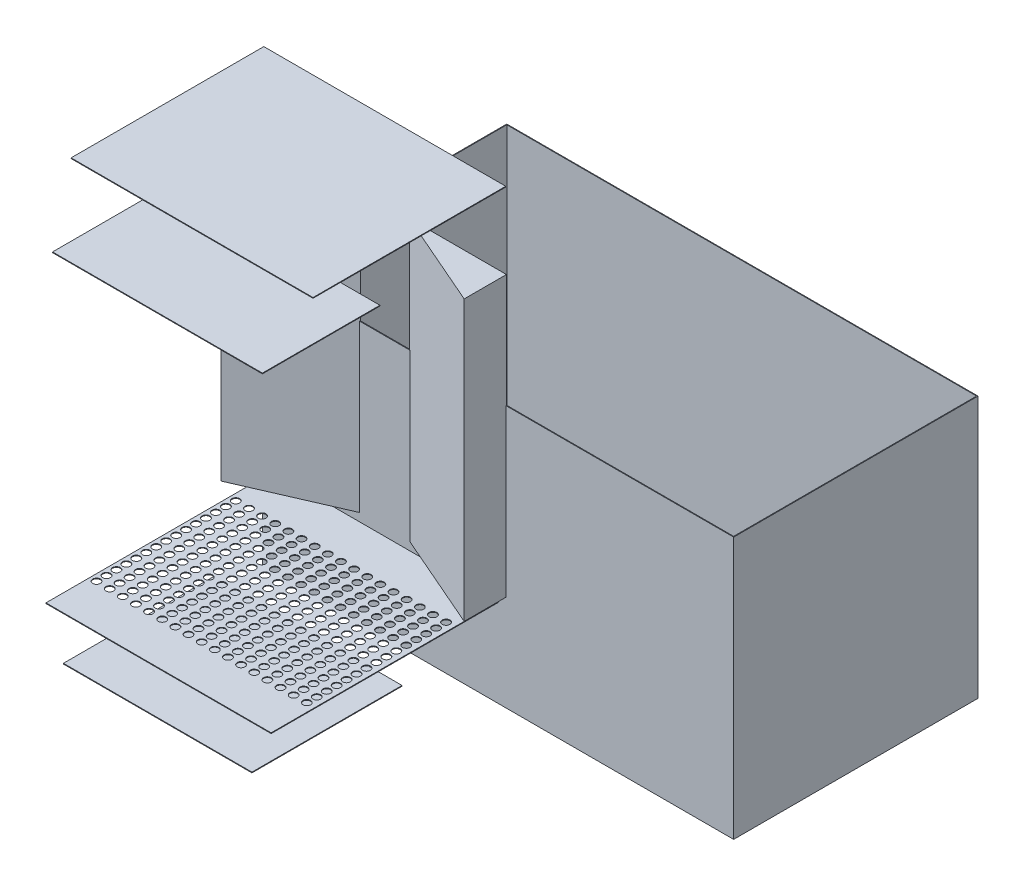
from build123d import *

# Parameters (mm, degrees)
MASTER_FOOTPRINT_W            = 1350
MASTER_FOOTPRINT_H            = 700
BATH_BASE_PLATE_DEPTH         = 750
BATH_SHELL_2MM_T              = -2
INLET_IMPACT_BAFFLE_START     = 125
SKETCH_1_W                    = 540
SKETCH_1_H                    = 430
INLET_IMPACT_BAFFLE_DEPTH     = 2
DISTRIBUTOR_D22_START         = 250
SKETCH_2_W                    = 645
SKETCH_2_H                    = 652
SKETCH_2_R                    = 11
DISTRIBUTOR_D22_DEPTH         = 2
OUTLET_SUBMERGED_BAFFLE_START = 1130
SKETCH_3_W                    = 601.176470588
SKETCH_3_H                    = 336.5
OUTLET_SUBMERGED_BAFFLE_DEPTH = 2
OVERFLOW_WEIR_Z550_START      = 1290
SKETCH_4_W                    = 693
SKETCH_4_H                    = 552
OVERFLOW_WEIR_Z550_DEPTH      = 2
SLOPED_SEDIMENT_FLOOR_START   = 275
SLOPED_SEDIMENT_FLOOR_DEPTH   = 800


with BuildPart() as part:
    # MASTER_FOOTPRINT → BATH_BASE_PLATE (new body)
    with BuildSketch(Plane(origin=(0, 0, 0), x_dir=(1, 0, 0), z_dir=(0, 1, 0))):
        with Locations((675, 350)):
            Rectangle(MASTER_FOOTPRINT_W, MASTER_FOOTPRINT_H)
    extrude(amount=BATH_BASE_PLATE_DEPTH)

    # BATH_SHELL_2MM
    bath_shell_2mm_openings = [part.faces().sort_by_distance(p)[0] for p in [
        (675, 750, -350),
    ]]
    offset(amount=BATH_SHELL_2MM_T, openings=bath_shell_2mm_openings, kind=Kind.INTERSECTION)

    # Эскиз5 → SLOPED_SEDIMENT_FLOOR (add)
    with BuildSketch(Plane(origin=(0, 0, 0), x_dir=(1, 0, 0), z_dir=(0, 1, 0)).offset(SLOPED_SEDIMENT_FLOOR_START)):
        Polygon((2, 1), (2, -120), (280, 1), align=None)
        Polygon((698, 1), (698, -120), (420, 1), align=None)
    extrude(amount=SLOPED_SEDIMENT_FLOOR_DEPTH)


with BuildPart() as body_2:
    # Эскиз1 → INLET_IMPACT_BAFFLE (new body)
    with BuildSketch(Plane(origin=(0, 0, 0), x_dir=(1, 0, 0), z_dir=(0, 1, 0)).offset(INLET_IMPACT_BAFFLE_START)):
        with Locations((350, -435)):
            Rectangle(SKETCH_1_W, SKETCH_1_H)
    extrude(amount=INLET_IMPACT_BAFFLE_DEPTH)


with BuildPart() as body_3:
    # Эскиз2 → DISTRIBUTOR_D22 (new body)
    with BuildSketch(Plane(origin=(0, 0, 0), x_dir=(1, 0, 0), z_dir=(0, 1, 0)).offset(DISTRIBUTOR_D22_START)):
        with Locations((352.5, -324)):
            Rectangle(SKETCH_2_W, SKETCH_2_H)
        with Locations(Location((48.823529412, -125, 0), (0, 0, 270))):
            Circle(SKETCH_2_R, mode=Mode.SUBTRACT)
        with Locations(Location((48.823529412, -153.5, 0), (0, 0, 270))):
            Circle(SKETCH_2_R, mode=Mode.SUBTRACT)
        with Locations(Location((48.823529412, -182, 0), (0, 0, 270))):
            Circle(SKETCH_2_R, mode=Mode.SUBTRACT)
        with Locations(Location((48.823529412, -210.5, 0), (0, 0, 270))):
            Circle(SKETCH_2_R, mode=Mode.SUBTRACT)
        with Locations(Location((48.823529412, -239, 0), (0, 0, 270))):
            Circle(SKETCH_2_R, mode=Mode.SUBTRACT)
        with Locations(Location((48.823529412, -267.5, 0), (0, 0, 270))):
            Circle(SKETCH_2_R, mode=Mode.SUBTRACT)
        with Locations(Location((48.823529412, -296, 0), (0, 0, 270))):
            Circle(SKETCH_2_R, mode=Mode.SUBTRACT)
        with Locations(Location((48.823529412, -324.5, 0), (0, 0, 270))):
            Circle(SKETCH_2_R, mode=Mode.SUBTRACT)
        with Locations(Location((48.823529412, -353, 0), (0, 0, 270))):
            Circle(SKETCH_2_R, mode=Mode.SUBTRACT)
        with Locations(Location((48.823529412, -381.5, 0), (0, 0, 270))):
            Circle(SKETCH_2_R, mode=Mode.SUBTRACT)
        with Locations(Location((48.823529412, -410, 0), (0, 0, 270))):
            Circle(SKETCH_2_R, mode=Mode.SUBTRACT)
        with Locations(Location((48.823529412, -438.5, 0), (0, 0, 270))):
            Circle(SKETCH_2_R, mode=Mode.SUBTRACT)
        with Locations(Location((48.823529412, -467, 0), (0, 0, 270))):
            Circle(SKETCH_2_R, mode=Mode.SUBTRACT)
        with Locations(Location((48.823529412, -495.5, 0), (0, 0, 270))):
            Circle(SKETCH_2_R, mode=Mode.SUBTRACT)
        with Locations(Location((48.823529412, -524, 0), (0, 0, 270))):
            Circle(SKETCH_2_R, mode=Mode.SUBTRACT)
        with Locations(Location((86.470588235, -125, 0), (0, 0, 270))):
            Circle(SKETCH_2_R, mode=Mode.SUBTRACT)
        with Locations(Location((86.470588235, -153.5, 0), (0, 0, 270))):
            Circle(SKETCH_2_R, mode=Mode.SUBTRACT)
        with Locations(Location((86.470588235, -182, 0), (0, 0, 270))):
            Circle(SKETCH_2_R, mode=Mode.SUBTRACT)
        with Locations(Location((86.470588235, -210.5, 0), (0, 0, 270))):
            Circle(SKETCH_2_R, mode=Mode.SUBTRACT)
        with Locations(Location((86.470588235, -239, 0), (0, 0, 270))):
            Circle(SKETCH_2_R, mode=Mode.SUBTRACT)
        with Locations(Location((86.470588235, -267.5, 0), (0, 0, 270))):
            Circle(SKETCH_2_R, mode=Mode.SUBTRACT)
        with Locations(Location((86.470588235, -296, 0), (0, 0, 270))):
            Circle(SKETCH_2_R, mode=Mode.SUBTRACT)
        with Locations(Location((86.470588235, -324.5, 0), (0, 0, 270))):
            Circle(SKETCH_2_R, mode=Mode.SUBTRACT)
        with Locations(Location((86.470588235, -353, 0), (0, 0, 270))):
            Circle(SKETCH_2_R, mode=Mode.SUBTRACT)
        with Locations(Location((86.470588235, -381.5, 0), (0, 0, 270))):
            Circle(SKETCH_2_R, mode=Mode.SUBTRACT)
        with Locations(Location((86.470588235, -410, 0), (0, 0, 270))):
            Circle(SKETCH_2_R, mode=Mode.SUBTRACT)
        with Locations(Location((86.470588235, -438.5, 0), (0, 0, 270))):
            Circle(SKETCH_2_R, mode=Mode.SUBTRACT)
        with Locations(Location((86.470588235, -467, 0), (0, 0, 270))):
            Circle(SKETCH_2_R, mode=Mode.SUBTRACT)
        with Locations(Location((86.470588235, -495.5, 0), (0, 0, 270))):
            Circle(SKETCH_2_R, mode=Mode.SUBTRACT)
        with Locations(Location((86.470588235, -524, 0), (0, 0, 270))):
            Circle(SKETCH_2_R, mode=Mode.SUBTRACT)
        with Locations(Location((124.117647059, -125, 0), (0, 0, 270))):
            Circle(SKETCH_2_R, mode=Mode.SUBTRACT)
        with Locations(Location((124.117647059, -153.5, 0), (0, 0, 270))):
            Circle(SKETCH_2_R, mode=Mode.SUBTRACT)
        with Locations(Location((124.117647059, -182, 0), (0, 0, 270))):
            Circle(SKETCH_2_R, mode=Mode.SUBTRACT)
        with Locations(Location((124.117647059, -210.5, 0), (0, 0, 270))):
            Circle(SKETCH_2_R, mode=Mode.SUBTRACT)
        with Locations(Location((124.117647059, -239, 0), (0, 0, 270))):
            Circle(SKETCH_2_R, mode=Mode.SUBTRACT)
        with Locations(Location((124.117647059, -267.5, 0), (0, 0, 270))):
            Circle(SKETCH_2_R, mode=Mode.SUBTRACT)
        with Locations(Location((124.117647059, -296, 0), (0, 0, 270))):
            Circle(SKETCH_2_R, mode=Mode.SUBTRACT)
        with Locations(Location((124.117647059, -324.5, 0), (0, 0, 270))):
            Circle(SKETCH_2_R, mode=Mode.SUBTRACT)
        with Locations(Location((124.117647059, -353, 0), (0, 0, 270))):
            Circle(SKETCH_2_R, mode=Mode.SUBTRACT)
        with Locations(Location((124.117647059, -381.5, 0), (0, 0, 270))):
            Circle(SKETCH_2_R, mode=Mode.SUBTRACT)
        with Locations(Location((124.117647059, -410, 0), (0, 0, 270))):
            Circle(SKETCH_2_R, mode=Mode.SUBTRACT)
        with Locations(Location((124.117647059, -438.5, 0), (0, 0, 270))):
            Circle(SKETCH_2_R, mode=Mode.SUBTRACT)
        with Locations(Location((124.117647059, -467, 0), (0, 0, 270))):
            Circle(SKETCH_2_R, mode=Mode.SUBTRACT)
        with Locations(Location((124.117647059, -495.5, 0), (0, 0, 270))):
            Circle(SKETCH_2_R, mode=Mode.SUBTRACT)
        with Locations(Location((124.117647059, -524, 0), (0, 0, 270))):
            Circle(SKETCH_2_R, mode=Mode.SUBTRACT)
        with Locations(Location((161.764705882, -125, 0), (0, 0, 270))):
            Circle(SKETCH_2_R, mode=Mode.SUBTRACT)
        with Locations(Location((161.764705882, -153.5, 0), (0, 0, 270))):
            Circle(SKETCH_2_R, mode=Mode.SUBTRACT)
        with Locations(Location((161.764705882, -182, 0), (0, 0, 270))):
            Circle(SKETCH_2_R, mode=Mode.SUBTRACT)
        with Locations(Location((161.764705882, -210.5, 0), (0, 0, 270))):
            Circle(SKETCH_2_R, mode=Mode.SUBTRACT)
        with Locations(Location((161.764705882, -239, 0), (0, 0, 270))):
            Circle(SKETCH_2_R, mode=Mode.SUBTRACT)
        with Locations(Location((161.764705882, -267.5, 0), (0, 0, 270))):
            Circle(SKETCH_2_R, mode=Mode.SUBTRACT)
        with Locations(Location((161.764705882, -296, 0), (0, 0, 270))):
            Circle(SKETCH_2_R, mode=Mode.SUBTRACT)
        with Locations(Location((161.764705882, -324.5, 0), (0, 0, 270))):
            Circle(SKETCH_2_R, mode=Mode.SUBTRACT)
        with Locations(Location((161.764705882, -353, 0), (0, 0, 270))):
            Circle(SKETCH_2_R, mode=Mode.SUBTRACT)
        with Locations(Location((161.764705882, -381.5, 0), (0, 0, 270))):
            Circle(SKETCH_2_R, mode=Mode.SUBTRACT)
        with Locations(Location((161.764705882, -410, 0), (0, 0, 270))):
            Circle(SKETCH_2_R, mode=Mode.SUBTRACT)
        with Locations(Location((161.764705882, -438.5, 0), (0, 0, 270))):
            Circle(SKETCH_2_R, mode=Mode.SUBTRACT)
        with Locations(Location((161.764705882, -467, 0), (0, 0, 270))):
            Circle(SKETCH_2_R, mode=Mode.SUBTRACT)
        with Locations(Location((161.764705882, -495.5, 0), (0, 0, 270))):
            Circle(SKETCH_2_R, mode=Mode.SUBTRACT)
        with Locations(Location((161.764705882, -524, 0), (0, 0, 270))):
            Circle(SKETCH_2_R, mode=Mode.SUBTRACT)
        with Locations(Location((199.411764706, -125, 0), (0, 0, 270))):
            Circle(SKETCH_2_R, mode=Mode.SUBTRACT)
        with Locations(Location((199.411764706, -153.5, 0), (0, 0, 270))):
            Circle(SKETCH_2_R, mode=Mode.SUBTRACT)
        with Locations(Location((199.411764706, -182, 0), (0, 0, 270))):
            Circle(SKETCH_2_R, mode=Mode.SUBTRACT)
        with Locations(Location((199.411764706, -210.5, 0), (0, 0, 270))):
            Circle(SKETCH_2_R, mode=Mode.SUBTRACT)
        with Locations(Location((199.411764706, -239, 0), (0, 0, 270))):
            Circle(SKETCH_2_R, mode=Mode.SUBTRACT)
        with Locations(Location((199.411764706, -267.5, 0), (0, 0, 270))):
            Circle(SKETCH_2_R, mode=Mode.SUBTRACT)
        with Locations(Location((199.411764706, -296, 0), (0, 0, 270))):
            Circle(SKETCH_2_R, mode=Mode.SUBTRACT)
        with Locations(Location((199.411764706, -324.5, 0), (0, 0, 270))):
            Circle(SKETCH_2_R, mode=Mode.SUBTRACT)
        with Locations(Location((199.411764706, -353, 0), (0, 0, 270))):
            Circle(SKETCH_2_R, mode=Mode.SUBTRACT)
        with Locations(Location((199.411764706, -381.5, 0), (0, 0, 270))):
            Circle(SKETCH_2_R, mode=Mode.SUBTRACT)
        with Locations(Location((199.411764706, -410, 0), (0, 0, 270))):
            Circle(SKETCH_2_R, mode=Mode.SUBTRACT)
        with Locations(Location((199.411764706, -438.5, 0), (0, 0, 270))):
            Circle(SKETCH_2_R, mode=Mode.SUBTRACT)
        with Locations(Location((199.411764706, -467, 0), (0, 0, 270))):
            Circle(SKETCH_2_R, mode=Mode.SUBTRACT)
        with Locations(Location((199.411764706, -495.5, 0), (0, 0, 270))):
            Circle(SKETCH_2_R, mode=Mode.SUBTRACT)
        with Locations(Location((199.411764706, -524, 0), (0, 0, 270))):
            Circle(SKETCH_2_R, mode=Mode.SUBTRACT)
        with Locations(Location((237.058823529, -125, 0), (0, 0, 270))):
            Circle(SKETCH_2_R, mode=Mode.SUBTRACT)
        with Locations(Location((237.058823529, -153.5, 0), (0, 0, 270))):
            Circle(SKETCH_2_R, mode=Mode.SUBTRACT)
        with Locations(Location((237.058823529, -182, 0), (0, 0, 270))):
            Circle(SKETCH_2_R, mode=Mode.SUBTRACT)
        with Locations(Location((237.058823529, -210.5, 0), (0, 0, 270))):
            Circle(SKETCH_2_R, mode=Mode.SUBTRACT)
        with Locations(Location((237.058823529, -239, 0), (0, 0, 270))):
            Circle(SKETCH_2_R, mode=Mode.SUBTRACT)
        with Locations(Location((237.058823529, -267.5, 0), (0, 0, 270))):
            Circle(SKETCH_2_R, mode=Mode.SUBTRACT)
        with Locations(Location((237.058823529, -296, 0), (0, 0, 270))):
            Circle(SKETCH_2_R, mode=Mode.SUBTRACT)
        with Locations(Location((237.058823529, -324.5, 0), (0, 0, 270))):
            Circle(SKETCH_2_R, mode=Mode.SUBTRACT)
        with Locations(Location((237.058823529, -353, 0), (0, 0, 270))):
            Circle(SKETCH_2_R, mode=Mode.SUBTRACT)
        with Locations(Location((237.058823529, -381.5, 0), (0, 0, 270))):
            Circle(SKETCH_2_R, mode=Mode.SUBTRACT)
        with Locations(Location((237.058823529, -410, 0), (0, 0, 270))):
            Circle(SKETCH_2_R, mode=Mode.SUBTRACT)
        with Locations(Location((237.058823529, -438.5, 0), (0, 0, 270))):
            Circle(SKETCH_2_R, mode=Mode.SUBTRACT)
        with Locations(Location((237.058823529, -467, 0), (0, 0, 270))):
            Circle(SKETCH_2_R, mode=Mode.SUBTRACT)
        with Locations(Location((237.058823529, -495.5, 0), (0, 0, 270))):
            Circle(SKETCH_2_R, mode=Mode.SUBTRACT)
        with Locations(Location((237.058823529, -524, 0), (0, 0, 270))):
            Circle(SKETCH_2_R, mode=Mode.SUBTRACT)
        with Locations(Location((274.705882353, -125, 0), (0, 0, 270))):
            Circle(SKETCH_2_R, mode=Mode.SUBTRACT)
        with Locations(Location((274.705882353, -153.5, 0), (0, 0, 270))):
            Circle(SKETCH_2_R, mode=Mode.SUBTRACT)
        with Locations(Location((274.705882353, -182, 0), (0, 0, 270))):
            Circle(SKETCH_2_R, mode=Mode.SUBTRACT)
        with Locations(Location((274.705882353, -210.5, 0), (0, 0, 270))):
            Circle(SKETCH_2_R, mode=Mode.SUBTRACT)
        with Locations(Location((274.705882353, -239, 0), (0, 0, 270))):
            Circle(SKETCH_2_R, mode=Mode.SUBTRACT)
        with Locations(Location((274.705882353, -267.5, 0), (0, 0, 270))):
            Circle(SKETCH_2_R, mode=Mode.SUBTRACT)
        with Locations(Location((274.705882353, -296, 0), (0, 0, 270))):
            Circle(SKETCH_2_R, mode=Mode.SUBTRACT)
        with Locations(Location((274.705882353, -324.5, 0), (0, 0, 270))):
            Circle(SKETCH_2_R, mode=Mode.SUBTRACT)
        with Locations(Location((274.705882353, -353, 0), (0, 0, 270))):
            Circle(SKETCH_2_R, mode=Mode.SUBTRACT)
        with Locations(Location((274.705882353, -381.5, 0), (0, 0, 270))):
            Circle(SKETCH_2_R, mode=Mode.SUBTRACT)
        with Locations(Location((274.705882353, -410, 0), (0, 0, 270))):
            Circle(SKETCH_2_R, mode=Mode.SUBTRACT)
        with Locations(Location((274.705882353, -438.5, 0), (0, 0, 270))):
            Circle(SKETCH_2_R, mode=Mode.SUBTRACT)
        with Locations(Location((274.705882353, -467, 0), (0, 0, 270))):
            Circle(SKETCH_2_R, mode=Mode.SUBTRACT)
        with Locations(Location((274.705882353, -495.5, 0), (0, 0, 270))):
            Circle(SKETCH_2_R, mode=Mode.SUBTRACT)
        with Locations(Location((274.705882353, -524, 0), (0, 0, 270))):
            Circle(SKETCH_2_R, mode=Mode.SUBTRACT)
        with Locations(Location((312.352941176, -125, 0), (0, 0, 270))):
            Circle(SKETCH_2_R, mode=Mode.SUBTRACT)
        with Locations(Location((312.352941176, -153.5, 0), (0, 0, 270))):
            Circle(SKETCH_2_R, mode=Mode.SUBTRACT)
        with Locations(Location((312.352941176, -182, 0), (0, 0, 270))):
            Circle(SKETCH_2_R, mode=Mode.SUBTRACT)
        with Locations(Location((312.352941176, -210.5, 0), (0, 0, 270))):
            Circle(SKETCH_2_R, mode=Mode.SUBTRACT)
        with Locations(Location((312.352941176, -239, 0), (0, 0, 270))):
            Circle(SKETCH_2_R, mode=Mode.SUBTRACT)
        with Locations(Location((312.352941176, -267.5, 0), (0, 0, 270))):
            Circle(SKETCH_2_R, mode=Mode.SUBTRACT)
        with Locations(Location((312.352941176, -296, 0), (0, 0, 270))):
            Circle(SKETCH_2_R, mode=Mode.SUBTRACT)
        with Locations(Location((312.352941176, -324.5, 0), (0, 0, 270))):
            Circle(SKETCH_2_R, mode=Mode.SUBTRACT)
        with Locations(Location((312.352941176, -353, 0), (0, 0, 270))):
            Circle(SKETCH_2_R, mode=Mode.SUBTRACT)
        with Locations(Location((312.352941176, -381.5, 0), (0, 0, 270))):
            Circle(SKETCH_2_R, mode=Mode.SUBTRACT)
        with Locations(Location((312.352941176, -410, 0), (0, 0, 270))):
            Circle(SKETCH_2_R, mode=Mode.SUBTRACT)
        with Locations(Location((312.352941176, -438.5, 0), (0, 0, 270))):
            Circle(SKETCH_2_R, mode=Mode.SUBTRACT)
        with Locations(Location((312.352941176, -467, 0), (0, 0, 270))):
            Circle(SKETCH_2_R, mode=Mode.SUBTRACT)
        with Locations(Location((312.352941176, -495.5, 0), (0, 0, 270))):
            Circle(SKETCH_2_R, mode=Mode.SUBTRACT)
        with Locations(Location((312.352941176, -524, 0), (0, 0, 270))):
            Circle(SKETCH_2_R, mode=Mode.SUBTRACT)
        with Locations(Location((350, -125, 0), (0, 0, 270))):
            Circle(SKETCH_2_R, mode=Mode.SUBTRACT)
        with Locations(Location((350, -153.5, 0), (0, 0, 270))):
            Circle(SKETCH_2_R, mode=Mode.SUBTRACT)
        with Locations(Location((350, -182, 0), (0, 0, 270))):
            Circle(SKETCH_2_R, mode=Mode.SUBTRACT)
        with Locations(Location((350, -210.5, 0), (0, 0, 270))):
            Circle(SKETCH_2_R, mode=Mode.SUBTRACT)
        with Locations(Location((350, -239, 0), (0, 0, 270))):
            Circle(SKETCH_2_R, mode=Mode.SUBTRACT)
        with Locations(Location((350, -267.5, 0), (0, 0, 270))):
            Circle(SKETCH_2_R, mode=Mode.SUBTRACT)
        with Locations(Location((350, -296, 0), (0, 0, 270))):
            Circle(SKETCH_2_R, mode=Mode.SUBTRACT)
        with Locations(Location((350, -324.5, 0), (0, 0, 270))):
            Circle(SKETCH_2_R, mode=Mode.SUBTRACT)
        with Locations(Location((350, -353, 0), (0, 0, 270))):
            Circle(SKETCH_2_R, mode=Mode.SUBTRACT)
        with Locations(Location((350, -381.5, 0), (0, 0, 270))):
            Circle(SKETCH_2_R, mode=Mode.SUBTRACT)
        with Locations(Location((350, -410, 0), (0, 0, 270))):
            Circle(SKETCH_2_R, mode=Mode.SUBTRACT)
        with Locations(Location((350, -438.5, 0), (0, 0, 270))):
            Circle(SKETCH_2_R, mode=Mode.SUBTRACT)
        with Locations(Location((350, -467, 0), (0, 0, 270))):
            Circle(SKETCH_2_R, mode=Mode.SUBTRACT)
        with Locations(Location((350, -495.5, 0), (0, 0, 270))):
            Circle(SKETCH_2_R, mode=Mode.SUBTRACT)
        with Locations(Location((350, -524, 0), (0, 0, 270))):
            Circle(SKETCH_2_R, mode=Mode.SUBTRACT)
        with Locations(Location((387.647058824, -125, 0), (0, 0, 270))):
            Circle(SKETCH_2_R, mode=Mode.SUBTRACT)
        with Locations(Location((387.647058824, -153.5, 0), (0, 0, 270))):
            Circle(SKETCH_2_R, mode=Mode.SUBTRACT)
        with Locations(Location((387.647058824, -182, 0), (0, 0, 270))):
            Circle(SKETCH_2_R, mode=Mode.SUBTRACT)
        with Locations(Location((387.647058824, -210.5, 0), (0, 0, 270))):
            Circle(SKETCH_2_R, mode=Mode.SUBTRACT)
        with Locations(Location((387.647058824, -239, 0), (0, 0, 270))):
            Circle(SKETCH_2_R, mode=Mode.SUBTRACT)
        with Locations(Location((387.647058824, -267.5, 0), (0, 0, 270))):
            Circle(SKETCH_2_R, mode=Mode.SUBTRACT)
        with Locations(Location((387.647058824, -296, 0), (0, 0, 270))):
            Circle(SKETCH_2_R, mode=Mode.SUBTRACT)
        with Locations(Location((387.647058824, -324.5, 0), (0, 0, 270))):
            Circle(SKETCH_2_R, mode=Mode.SUBTRACT)
        with Locations(Location((387.647058824, -353, 0), (0, 0, 270))):
            Circle(SKETCH_2_R, mode=Mode.SUBTRACT)
        with Locations(Location((387.647058824, -381.5, 0), (0, 0, 270))):
            Circle(SKETCH_2_R, mode=Mode.SUBTRACT)
        with Locations(Location((387.647058824, -410, 0), (0, 0, 270))):
            Circle(SKETCH_2_R, mode=Mode.SUBTRACT)
        with Locations(Location((387.647058824, -438.5, 0), (0, 0, 270))):
            Circle(SKETCH_2_R, mode=Mode.SUBTRACT)
        with Locations(Location((387.647058824, -467, 0), (0, 0, 270))):
            Circle(SKETCH_2_R, mode=Mode.SUBTRACT)
        with Locations(Location((387.647058824, -495.5, 0), (0, 0, 270))):
            Circle(SKETCH_2_R, mode=Mode.SUBTRACT)
        with Locations(Location((387.647058824, -524, 0), (0, 0, 270))):
            Circle(SKETCH_2_R, mode=Mode.SUBTRACT)
        with Locations(Location((425.294117647, -125, 0), (0, 0, 270))):
            Circle(SKETCH_2_R, mode=Mode.SUBTRACT)
        with Locations(Location((425.294117647, -153.5, 0), (0, 0, 270))):
            Circle(SKETCH_2_R, mode=Mode.SUBTRACT)
        with Locations(Location((425.294117647, -182, 0), (0, 0, 270))):
            Circle(SKETCH_2_R, mode=Mode.SUBTRACT)
        with Locations(Location((425.294117647, -210.5, 0), (0, 0, 270))):
            Circle(SKETCH_2_R, mode=Mode.SUBTRACT)
        with Locations(Location((425.294117647, -239, 0), (0, 0, 270))):
            Circle(SKETCH_2_R, mode=Mode.SUBTRACT)
        with Locations(Location((425.294117647, -267.5, 0), (0, 0, 270))):
            Circle(SKETCH_2_R, mode=Mode.SUBTRACT)
        with Locations(Location((425.294117647, -296, 0), (0, 0, 270))):
            Circle(SKETCH_2_R, mode=Mode.SUBTRACT)
        with Locations(Location((425.294117647, -324.5, 0), (0, 0, 270))):
            Circle(SKETCH_2_R, mode=Mode.SUBTRACT)
        with Locations(Location((425.294117647, -353, 0), (0, 0, 270))):
            Circle(SKETCH_2_R, mode=Mode.SUBTRACT)
        with Locations(Location((425.294117647, -381.5, 0), (0, 0, 270))):
            Circle(SKETCH_2_R, mode=Mode.SUBTRACT)
        with Locations(Location((425.294117647, -410, 0), (0, 0, 270))):
            Circle(SKETCH_2_R, mode=Mode.SUBTRACT)
        with Locations(Location((425.294117647, -438.5, 0), (0, 0, 270))):
            Circle(SKETCH_2_R, mode=Mode.SUBTRACT)
        with Locations(Location((425.294117647, -467, 0), (0, 0, 270))):
            Circle(SKETCH_2_R, mode=Mode.SUBTRACT)
        with Locations(Location((425.294117647, -495.5, 0), (0, 0, 270))):
            Circle(SKETCH_2_R, mode=Mode.SUBTRACT)
        with Locations(Location((425.294117647, -524, 0), (0, 0, 270))):
            Circle(SKETCH_2_R, mode=Mode.SUBTRACT)
        with Locations(Location((462.941176471, -125, 0), (0, 0, 270))):
            Circle(SKETCH_2_R, mode=Mode.SUBTRACT)
        with Locations(Location((462.941176471, -153.5, 0), (0, 0, 270))):
            Circle(SKETCH_2_R, mode=Mode.SUBTRACT)
        with Locations(Location((462.941176471, -182, 0), (0, 0, 270))):
            Circle(SKETCH_2_R, mode=Mode.SUBTRACT)
        with Locations(Location((462.941176471, -210.5, 0), (0, 0, 270))):
            Circle(SKETCH_2_R, mode=Mode.SUBTRACT)
        with Locations(Location((462.941176471, -239, 0), (0, 0, 270))):
            Circle(SKETCH_2_R, mode=Mode.SUBTRACT)
        with Locations(Location((462.941176471, -267.5, 0), (0, 0, 270))):
            Circle(SKETCH_2_R, mode=Mode.SUBTRACT)
        with Locations(Location((462.941176471, -296, 0), (0, 0, 270))):
            Circle(SKETCH_2_R, mode=Mode.SUBTRACT)
        with Locations(Location((462.941176471, -324.5, 0), (0, 0, 270))):
            Circle(SKETCH_2_R, mode=Mode.SUBTRACT)
        with Locations(Location((462.941176471, -353, 0), (0, 0, 270))):
            Circle(SKETCH_2_R, mode=Mode.SUBTRACT)
        with Locations(Location((462.941176471, -381.5, 0), (0, 0, 270))):
            Circle(SKETCH_2_R, mode=Mode.SUBTRACT)
        with Locations(Location((462.941176471, -410, 0), (0, 0, 270))):
            Circle(SKETCH_2_R, mode=Mode.SUBTRACT)
        with Locations(Location((462.941176471, -438.5, 0), (0, 0, 270))):
            Circle(SKETCH_2_R, mode=Mode.SUBTRACT)
        with Locations(Location((462.941176471, -467, 0), (0, 0, 270))):
            Circle(SKETCH_2_R, mode=Mode.SUBTRACT)
        with Locations(Location((462.941176471, -495.5, 0), (0, 0, 270))):
            Circle(SKETCH_2_R, mode=Mode.SUBTRACT)
        with Locations(Location((462.941176471, -524, 0), (0, 0, 270))):
            Circle(SKETCH_2_R, mode=Mode.SUBTRACT)
        with Locations(Location((500.588235294, -125, 0), (0, 0, 270))):
            Circle(SKETCH_2_R, mode=Mode.SUBTRACT)
        with Locations(Location((500.588235294, -153.5, 0), (0, 0, 270))):
            Circle(SKETCH_2_R, mode=Mode.SUBTRACT)
        with Locations(Location((500.588235294, -182, 0), (0, 0, 270))):
            Circle(SKETCH_2_R, mode=Mode.SUBTRACT)
        with Locations(Location((500.588235294, -210.5, 0), (0, 0, 270))):
            Circle(SKETCH_2_R, mode=Mode.SUBTRACT)
        with Locations(Location((500.588235294, -239, 0), (0, 0, 270))):
            Circle(SKETCH_2_R, mode=Mode.SUBTRACT)
        with Locations(Location((500.588235294, -267.5, 0), (0, 0, 270))):
            Circle(SKETCH_2_R, mode=Mode.SUBTRACT)
        with Locations(Location((500.588235294, -296, 0), (0, 0, 270))):
            Circle(SKETCH_2_R, mode=Mode.SUBTRACT)
        with Locations(Location((500.588235294, -324.5, 0), (0, 0, 270))):
            Circle(SKETCH_2_R, mode=Mode.SUBTRACT)
        with Locations(Location((500.588235294, -353, 0), (0, 0, 270))):
            Circle(SKETCH_2_R, mode=Mode.SUBTRACT)
        with Locations(Location((500.588235294, -381.5, 0), (0, 0, 270))):
            Circle(SKETCH_2_R, mode=Mode.SUBTRACT)
        with Locations(Location((500.588235294, -410, 0), (0, 0, 270))):
            Circle(SKETCH_2_R, mode=Mode.SUBTRACT)
        with Locations(Location((500.588235294, -438.5, 0), (0, 0, 270))):
            Circle(SKETCH_2_R, mode=Mode.SUBTRACT)
        with Locations(Location((500.588235294, -467, 0), (0, 0, 270))):
            Circle(SKETCH_2_R, mode=Mode.SUBTRACT)
        with Locations(Location((500.588235294, -495.5, 0), (0, 0, 270))):
            Circle(SKETCH_2_R, mode=Mode.SUBTRACT)
        with Locations(Location((500.588235294, -524, 0), (0, 0, 270))):
            Circle(SKETCH_2_R, mode=Mode.SUBTRACT)
        with Locations(Location((538.235294118, -125, 0), (0, 0, 270))):
            Circle(SKETCH_2_R, mode=Mode.SUBTRACT)
        with Locations(Location((538.235294118, -153.5, 0), (0, 0, 270))):
            Circle(SKETCH_2_R, mode=Mode.SUBTRACT)
        with Locations(Location((538.235294118, -182, 0), (0, 0, 270))):
            Circle(SKETCH_2_R, mode=Mode.SUBTRACT)
        with Locations(Location((538.235294118, -210.5, 0), (0, 0, 270))):
            Circle(SKETCH_2_R, mode=Mode.SUBTRACT)
        with Locations(Location((538.235294118, -239, 0), (0, 0, 270))):
            Circle(SKETCH_2_R, mode=Mode.SUBTRACT)
        with Locations(Location((538.235294118, -267.5, 0), (0, 0, 270))):
            Circle(SKETCH_2_R, mode=Mode.SUBTRACT)
        with Locations(Location((538.235294118, -296, 0), (0, 0, 270))):
            Circle(SKETCH_2_R, mode=Mode.SUBTRACT)
        with Locations(Location((538.235294118, -324.5, 0), (0, 0, 270))):
            Circle(SKETCH_2_R, mode=Mode.SUBTRACT)
        with Locations(Location((538.235294118, -353, 0), (0, 0, 270))):
            Circle(SKETCH_2_R, mode=Mode.SUBTRACT)
        with Locations(Location((538.235294118, -381.5, 0), (0, 0, 270))):
            Circle(SKETCH_2_R, mode=Mode.SUBTRACT)
        with Locations(Location((538.235294118, -410, 0), (0, 0, 270))):
            Circle(SKETCH_2_R, mode=Mode.SUBTRACT)
        with Locations(Location((538.235294118, -438.5, 0), (0, 0, 270))):
            Circle(SKETCH_2_R, mode=Mode.SUBTRACT)
        with Locations(Location((538.235294118, -467, 0), (0, 0, 270))):
            Circle(SKETCH_2_R, mode=Mode.SUBTRACT)
        with Locations(Location((538.235294118, -495.5, 0), (0, 0, 270))):
            Circle(SKETCH_2_R, mode=Mode.SUBTRACT)
        with Locations(Location((538.235294118, -524, 0), (0, 0, 270))):
            Circle(SKETCH_2_R, mode=Mode.SUBTRACT)
        with Locations(Location((575.882352941, -125, 0), (0, 0, 270))):
            Circle(SKETCH_2_R, mode=Mode.SUBTRACT)
        with Locations(Location((575.882352941, -153.5, 0), (0, 0, 270))):
            Circle(SKETCH_2_R, mode=Mode.SUBTRACT)
        with Locations(Location((575.882352941, -182, 0), (0, 0, 270))):
            Circle(SKETCH_2_R, mode=Mode.SUBTRACT)
        with Locations(Location((575.882352941, -210.5, 0), (0, 0, 270))):
            Circle(SKETCH_2_R, mode=Mode.SUBTRACT)
        with Locations(Location((575.882352941, -239, 0), (0, 0, 270))):
            Circle(SKETCH_2_R, mode=Mode.SUBTRACT)
        with Locations(Location((575.882352941, -267.5, 0), (0, 0, 270))):
            Circle(SKETCH_2_R, mode=Mode.SUBTRACT)
        with Locations(Location((575.882352941, -296, 0), (0, 0, 270))):
            Circle(SKETCH_2_R, mode=Mode.SUBTRACT)
        with Locations(Location((575.882352941, -324.5, 0), (0, 0, 270))):
            Circle(SKETCH_2_R, mode=Mode.SUBTRACT)
        with Locations(Location((575.882352941, -353, 0), (0, 0, 270))):
            Circle(SKETCH_2_R, mode=Mode.SUBTRACT)
        with Locations(Location((575.882352941, -381.5, 0), (0, 0, 270))):
            Circle(SKETCH_2_R, mode=Mode.SUBTRACT)
        with Locations(Location((575.882352941, -410, 0), (0, 0, 270))):
            Circle(SKETCH_2_R, mode=Mode.SUBTRACT)
        with Locations(Location((575.882352941, -438.5, 0), (0, 0, 270))):
            Circle(SKETCH_2_R, mode=Mode.SUBTRACT)
        with Locations(Location((575.882352941, -467, 0), (0, 0, 270))):
            Circle(SKETCH_2_R, mode=Mode.SUBTRACT)
        with Locations(Location((575.882352941, -495.5, 0), (0, 0, 270))):
            Circle(SKETCH_2_R, mode=Mode.SUBTRACT)
        with Locations(Location((575.882352941, -524, 0), (0, 0, 270))):
            Circle(SKETCH_2_R, mode=Mode.SUBTRACT)
        with Locations(Location((613.529411765, -125, 0), (0, 0, 270))):
            Circle(SKETCH_2_R, mode=Mode.SUBTRACT)
        with Locations(Location((613.529411765, -153.5, 0), (0, 0, 270))):
            Circle(SKETCH_2_R, mode=Mode.SUBTRACT)
        with Locations(Location((613.529411765, -182, 0), (0, 0, 270))):
            Circle(SKETCH_2_R, mode=Mode.SUBTRACT)
        with Locations(Location((613.529411765, -210.5, 0), (0, 0, 270))):
            Circle(SKETCH_2_R, mode=Mode.SUBTRACT)
        with Locations(Location((613.529411765, -239, 0), (0, 0, 270))):
            Circle(SKETCH_2_R, mode=Mode.SUBTRACT)
        with Locations(Location((613.529411765, -267.5, 0), (0, 0, 270))):
            Circle(SKETCH_2_R, mode=Mode.SUBTRACT)
        with Locations(Location((613.529411765, -296, 0), (0, 0, 270))):
            Circle(SKETCH_2_R, mode=Mode.SUBTRACT)
        with Locations(Location((613.529411765, -324.5, 0), (0, 0, 270))):
            Circle(SKETCH_2_R, mode=Mode.SUBTRACT)
        with Locations(Location((613.529411765, -353, 0), (0, 0, 270))):
            Circle(SKETCH_2_R, mode=Mode.SUBTRACT)
        with Locations(Location((613.529411765, -381.5, 0), (0, 0, 270))):
            Circle(SKETCH_2_R, mode=Mode.SUBTRACT)
        with Locations(Location((613.529411765, -410, 0), (0, 0, 270))):
            Circle(SKETCH_2_R, mode=Mode.SUBTRACT)
        with Locations(Location((613.529411765, -438.5, 0), (0, 0, 270))):
            Circle(SKETCH_2_R, mode=Mode.SUBTRACT)
        with Locations(Location((613.529411765, -467, 0), (0, 0, 270))):
            Circle(SKETCH_2_R, mode=Mode.SUBTRACT)
        with Locations(Location((613.529411765, -495.5, 0), (0, 0, 270))):
            Circle(SKETCH_2_R, mode=Mode.SUBTRACT)
        with Locations(Location((613.529411765, -524, 0), (0, 0, 270))):
            Circle(SKETCH_2_R, mode=Mode.SUBTRACT)
        with Locations(Location((651.176470588, -125, 0), (0, 0, 270))):
            Circle(SKETCH_2_R, mode=Mode.SUBTRACT)
        with Locations(Location((651.176470588, -153.5, 0), (0, 0, 270))):
            Circle(SKETCH_2_R, mode=Mode.SUBTRACT)
        with Locations(Location((651.176470588, -182, 0), (0, 0, 270))):
            Circle(SKETCH_2_R, mode=Mode.SUBTRACT)
        with Locations(Location((651.176470588, -210.5, 0), (0, 0, 270))):
            Circle(SKETCH_2_R, mode=Mode.SUBTRACT)
        with Locations(Location((651.176470588, -239, 0), (0, 0, 270))):
            Circle(SKETCH_2_R, mode=Mode.SUBTRACT)
        with Locations(Location((651.176470588, -267.5, 0), (0, 0, 270))):
            Circle(SKETCH_2_R, mode=Mode.SUBTRACT)
        with Locations(Location((651.176470588, -296, 0), (0, 0, 270))):
            Circle(SKETCH_2_R, mode=Mode.SUBTRACT)
        with Locations(Location((651.176470588, -324.5, 0), (0, 0, 270))):
            Circle(SKETCH_2_R, mode=Mode.SUBTRACT)
        with Locations(Location((651.176470588, -353, 0), (0, 0, 270))):
            Circle(SKETCH_2_R, mode=Mode.SUBTRACT)
        with Locations(Location((651.176470588, -381.5, 0), (0, 0, 270))):
            Circle(SKETCH_2_R, mode=Mode.SUBTRACT)
        with Locations(Location((651.176470588, -410, 0), (0, 0, 270))):
            Circle(SKETCH_2_R, mode=Mode.SUBTRACT)
        with Locations(Location((651.176470588, -438.5, 0), (0, 0, 270))):
            Circle(SKETCH_2_R, mode=Mode.SUBTRACT)
        with Locations(Location((651.176470588, -467, 0), (0, 0, 270))):
            Circle(SKETCH_2_R, mode=Mode.SUBTRACT)
        with Locations(Location((651.176470588, -495.5, 0), (0, 0, 270))):
            Circle(SKETCH_2_R, mode=Mode.SUBTRACT)
        with Locations(Location((651.176470588, -524, 0), (0, 0, 270))):
            Circle(SKETCH_2_R, mode=Mode.SUBTRACT)
    extrude(amount=DISTRIBUTOR_D22_DEPTH)


with BuildPart() as body_4:
    # Эскиз3 → OUTLET_SUBMERGED_BAFFLE (new body)
    with BuildSketch(Plane(origin=(0, 0, 0), x_dir=(1, 0, 0), z_dir=(0, 1, 0)).offset(OUTLET_SUBMERGED_BAFFLE_START)):
        with Locations((349.411764706, -481.75)):
            Rectangle(SKETCH_3_W, SKETCH_3_H)
    extrude(amount=OUTLET_SUBMERGED_BAFFLE_DEPTH)


with BuildPart() as body_5:
    # Эскиз4 → OVERFLOW_WEIR_Z550 (new body)
    with BuildSketch(Plane(origin=(0, 0, 0), x_dir=(1, 0, 0), z_dir=(0, 1, 0)).offset(OVERFLOW_WEIR_Z550_START)):
        with Locations((348.5, -274)):
            Rectangle(SKETCH_4_W, SKETCH_4_H)
    extrude(amount=OVERFLOW_WEIR_Z550_DEPTH)


solid = Compound([part.part, body_2.part, body_3.part, body_4.part, body_5.part])
